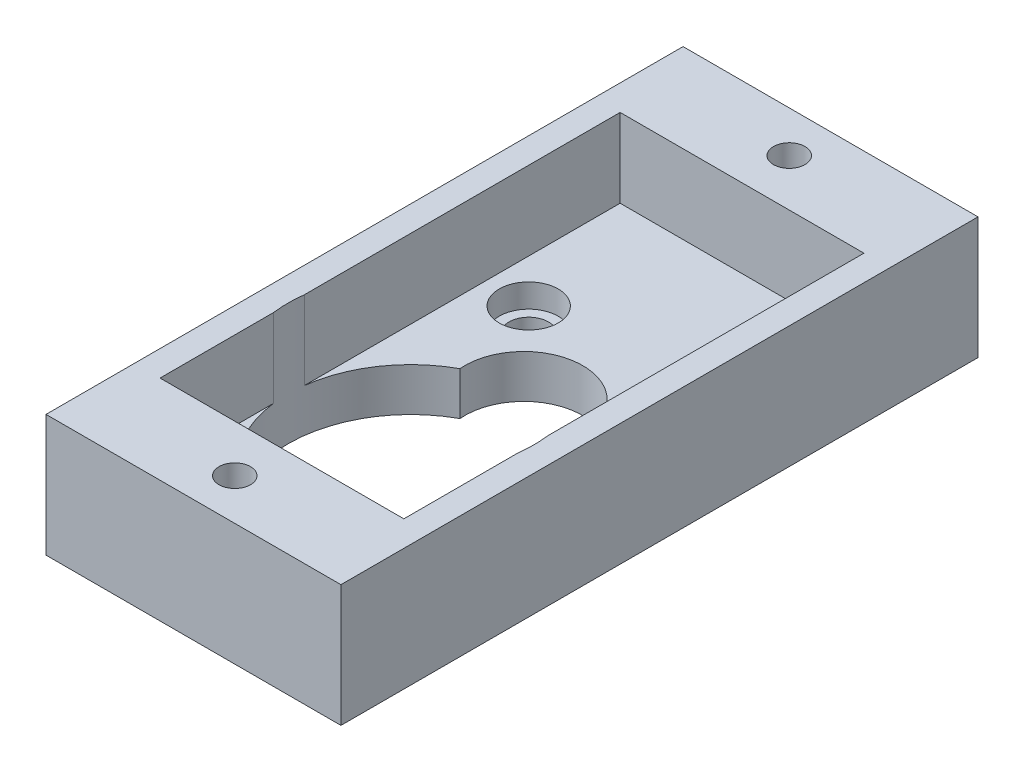
from build123d import *
from build123d.topology import SkipClean

# Parameters (mm, degrees)
SKETCH_1_W          = 15
SKETCH_1_H          = 32.4
EXTRUDE_1_DEPTH     = 2.2
SKETCH_1_3_R        = 6.25
SKETCH_1_3_R_2      = 3
CUT_EXTRUDE_1_DEPTH = 36.771497033
SKETCH_2_W          = 15
SKETCH_2_H          = 32.4
EXTRUDE_2_DEPTH     = 4
SKETCH_3_R          = 0.8
CUT_EXTRUDE_2_DEPTH = 3
SKETCH_4_R          = 1
CUT_EXTRUDE_3_DEPTH = 36.927148509
SKETCH_4_3_R        = 1.5
SKETCH_4_3_R_2      = 1
CUT_EXTRUDE_4_DEPTH = 1.2


with BuildPart() as part:
    # 草图1 → 凸台-拉伸1 (new body)
    with BuildSketch(Plane(origin=(0, 0, 0), x_dir=(1, 0, 0), z_dir=(0, 1, 0))):
        with Locations((7.5, -16.2)):
            Rectangle(SKETCH_1_W, SKETCH_1_H)
    extrude(amount=EXTRUDE_1_DEPTH)

    # 草图1<3> → 切除-拉伸1 (cut, through all)
    with BuildSketch(Plane(origin=(0, 0, 0), x_dir=(1, 0, 0), z_dir=(0, 1, 0))):
        with Locations((7.5, -21.35)):
            Circle(SKETCH_1_3_R)
        with Locations((7.5, -15.6)):
            Circle(SKETCH_1_3_R_2)
    extrude(amount=CUT_EXTRUDE_1_DEPTH, mode=Mode.SUBTRACT)

    # 草图2 → 凸台-拉伸2 (add)
    with SkipClean():  # the faces are left unmerged after this step: merging them gives an invalid solid
        with BuildSketch(Plane(origin=(0, 2.2, 0), x_dir=(1, 0, 0), z_dir=(0, 1, 0))):
            with Locations((7.5, -16.2)):
                Rectangle(SKETCH_2_W, SKETCH_2_H)
            with BuildLine():
                Line((13.7, -27.9), (1.3, -27.9))
                Line((1.3, -27.9), (1.3, -22.138986692))
                ThreePointArc((1.3, -22.138986692), (1.25, -21.35), (1.3, -20.561013308))
                Line((1.3, -20.561013308), (1.3, -4.5))
                Line((1.3, -4.5), (13.7, -4.5))
                Line((13.7, -4.5), (13.7, -20.561013308))
                ThreePointArc((13.7, -20.561013308), (13.75, -21.35), (13.7, -22.138986692))
                Line((13.7, -22.138986692), (13.7, -27.9))
            make_face(mode=Mode.SUBTRACT)
        extrude(amount=EXTRUDE_2_DEPTH)

    # 草图3 → 切除-拉伸2 (cut)
    with SkipClean():  # the faces are left unmerged after this step: merging them gives an invalid solid
        with BuildSketch(Plane(origin=(0, 6.2, 0), x_dir=(1, 0, 0), z_dir=(0, 1, 0))):
            with Locations((7.5, -30.3)):
                Circle(SKETCH_3_R)
            with Locations((7.5, -2.1)):
                Circle(SKETCH_3_R)
        extrude(amount=-CUT_EXTRUDE_2_DEPTH, mode=Mode.SUBTRACT)

    # 草图4 → 切除-拉伸3 (cut, through all)
    with SkipClean():  # the faces are left unmerged after this step: merging them gives an invalid solid
        with BuildSketch(Plane(origin=(0, 2.2, 0), x_dir=(1, 0, 0), z_dir=(0, 1, 0))):
            with Locations((11.5, -11.35)):
                Circle(SKETCH_4_R)
            with Locations((3.5, -11.35)):
                Circle(SKETCH_4_R)
        extrude(amount=-CUT_EXTRUDE_3_DEPTH, mode=Mode.SUBTRACT)

    # 草图4<3> → 切除-拉伸4 (cut)
    # profile 1 of 2: a face of its own
    with SkipClean():  # the faces are left unmerged after this step: merging them gives an invalid solid
        with BuildSketch(Plane(origin=(0, 2.2, 0), x_dir=(1, 0, 0), z_dir=(0, 1, 0))):
            with Locations((11.5, -11.35)):
                Circle(SKETCH_4_3_R)
            with Locations((11.5, -11.35)):
                Circle(SKETCH_4_3_R_2, mode=Mode.SUBTRACT)
        # profile 2 of 2: a face of its own
        with BuildSketch(Plane(origin=(0, 2.2, 0), x_dir=(1, 0, 0), z_dir=(0, 1, 0))):
            with Locations((3.5, -11.35)):
                Circle(SKETCH_4_3_R)
            with Locations((3.5, -11.35)):
                Circle(SKETCH_4_3_R_2, mode=Mode.SUBTRACT)
        extrude(amount=-CUT_EXTRUDE_4_DEPTH, mode=Mode.SUBTRACT)


solid = part.part
